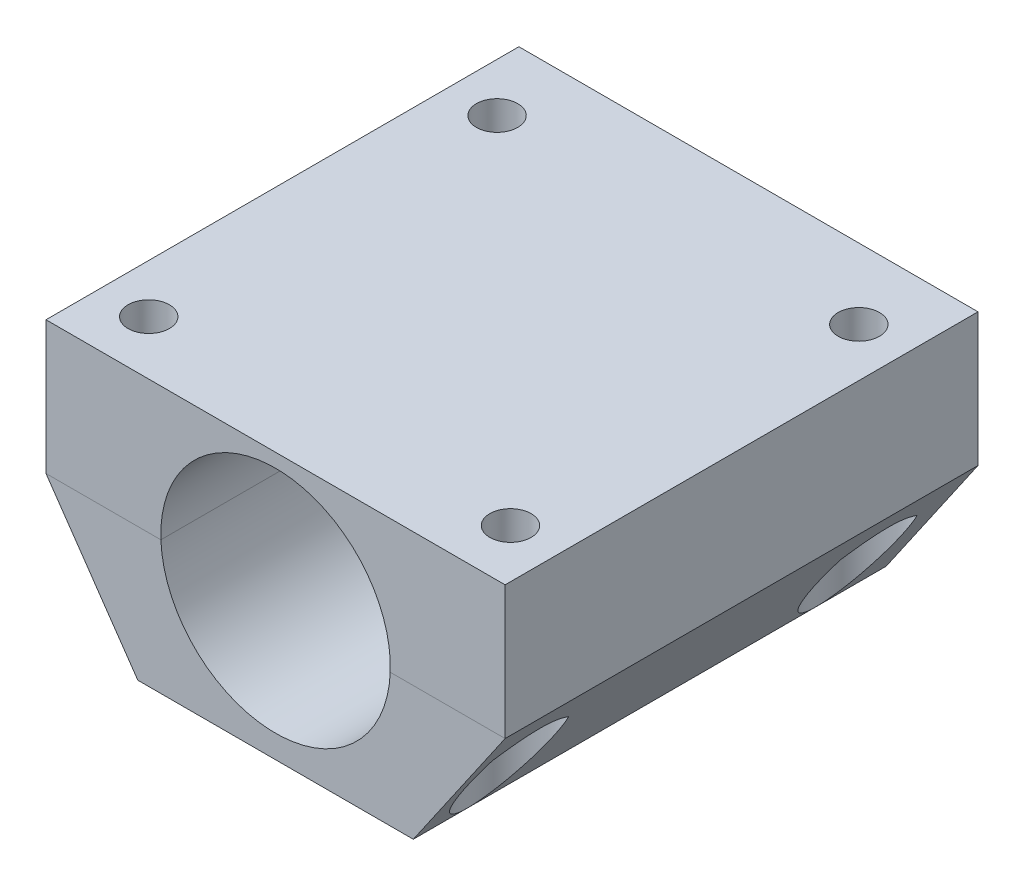
from build123d import *

# Parameters (mm, degrees)
ESQUISSE1_W                                 = 10
ESQUISSE1_H                                 = 14.5
ESQUISSE1_W_2                               = 30
ESQUISSE1_H_2                               = 29
ESQUISSE1_R                                 = 12.5
BOSS_EXTRU_1_DEPTH                          = 50
FRAISAGE_POUR_VIS_T_TE_FRAIS_E_M41_AT_COUNT = 2
FRAISAGE_POUR_VIS_T_TE_FRAIS_E_M41_AT_PITCH = 39.397349882
FRAISAGE_POUR_VIS_T_TE_FRAIS_E_M41_2_COUNT  = 2
FRAISAGE_POUR_VIS_T_TE_FRAIS_E_M41_2_PITCH  = 54.694216744
FRAISAGE_POUR_VIS_T_TE_FRAIS_E_M41_3_COUNT  = 2
FRAISAGE_POUR_VIS_T_TE_FRAIS_E_M41_3_PITCH  = 37.938188775
ESQUISSE26_R                                = 3.75
BOSS_EXTRU_2_DEPTH                          = 1.5
D_GAGEMENT_M31_D                            = 3.4


with BuildPart() as part:
    # Esquisse1 → Boss.-Extru.1 (new body)
    # profile 1 of 5: a face of its own
    with BuildSketch(Plane.XY):
        with Locations((-20, 6.75)):
            Rectangle(ESQUISSE1_W, ESQUISSE1_H)
    # profile 2 of 5: a face of its own
    with BuildSketch(Plane.XY):
        Polygon((-15, -15), (-15, -0.5), (-25, -0.5), align=None)
    # profile 3 of 5: a face of its own
    with BuildSketch(Plane.XY):
        with Locations((0, -0.5)):
            Rectangle(ESQUISSE1_W_2, ESQUISSE1_H_2)
        Circle(ESQUISSE1_R, mode=Mode.SUBTRACT)
    # profile 4 of 5: a face of its own
    with BuildSketch(Plane.XY):
        Polygon((25, -0.5), (15, -0.5), (15, -15), align=None)
    # profile 5 of 5: a face of its own
    with BuildSketch(Plane.XY):
        with Locations((20, 6.75)):
            Rectangle(ESQUISSE1_W, ESQUISSE1_H)
    extrude(amount=BOSS_EXTRU_1_DEPTH)

    # Esquisse25 → Fraisage pour vis à tête fraisée M41 (revolve, cut)
    with BuildSketch(Plane(origin=(19.698674941, -15, 6.176821723), x_dir=(0, 0, -1), z_dir=(1, 0, 0))):
        Polygon((0, 0), (0, 29), (2.25, 29), (2.25, 12.45), (4.7, 10), (4.7, 0), align=None)
    fraisage_pour_vis_t_te_frais_e_m41 = revolve(axis=Axis((19.698674941, -21.35, 6.176821723), (0, 1, 0)), mode=Mode.SUBTRACT)

    # Fraisage pour vis à tête fraisée M41 at: Fraisage pour vis à tête fraisée M41 ×2
    with Locations(*[(-i * FRAISAGE_POUR_VIS_T_TE_FRAIS_E_M41_AT_PITCH, 0, 0) for i in range(1, FRAISAGE_POUR_VIS_T_TE_FRAIS_E_M41_AT_COUNT)]):
        add(fraisage_pour_vis_t_te_frais_e_m41, mode=Mode.SUBTRACT)

    # Fraisage pour vis _ t_te frais_e M41 2: Fraisage pour vis à tête fraisée M41 ×2
    with Locations(*[Vector(-0.7203202134914811, 0, 0.6936416870658707) * (i * FRAISAGE_POUR_VIS_T_TE_FRAIS_E_M41_2_PITCH) for i in range(1, FRAISAGE_POUR_VIS_T_TE_FRAIS_E_M41_2_COUNT)]):
        add(fraisage_pour_vis_t_te_frais_e_m41, mode=Mode.SUBTRACT)

    # Fraisage pour vis _ t_te frais_e M41 3: Fraisage pour vis à tête fraisée M41 ×2
    with Locations(*[(0, 0, i * FRAISAGE_POUR_VIS_T_TE_FRAIS_E_M41_3_PITCH) for i in range(1, FRAISAGE_POUR_VIS_T_TE_FRAIS_E_M41_3_COUNT)]):
        add(fraisage_pour_vis_t_te_frais_e_m41, mode=Mode.SUBTRACT)

    # Esquisse26 → Boss.-Extru.2 (add)
    with BuildSketch(Plane(origin=(0, 0, 0), x_dir=(-1, 0, 0), z_dir=(0, 0, -1))):
        Polygon((-25, 14), (25, 14), (25, -0.5), (15, -15), (-15, -15), (-25, -0.5), align=None)
        Circle(ESQUISSE26_R, mode=Mode.SUBTRACT)
    extrude(amount=BOSS_EXTRU_2_DEPTH)

    # Dégagement M31 (through all)
    with Locations(Plane(origin=(0, 0, -1.5), x_dir=(-1, 0, 0), z_dir=(0, 0, -1))):
        with Locations((-8.5, 0), (8.5, 0)):
            Hole(D_GAGEMENT_M31_D / 2)


with BuildPart() as body_2:
    # Fractionner1: the piece on the far side of the plane
    add(part.part)
    split(bisect_by=Plane.ZX.offset(-0.5), keep=Keep.BOTTOM)


with BuildPart() as part_1:
    add(part.part)

    # Fractionner1
    split(bisect_by=Plane.ZX.offset(-0.5), keep=Keep.TOP)


solid = Compound([body_2.part, part_1.part])
